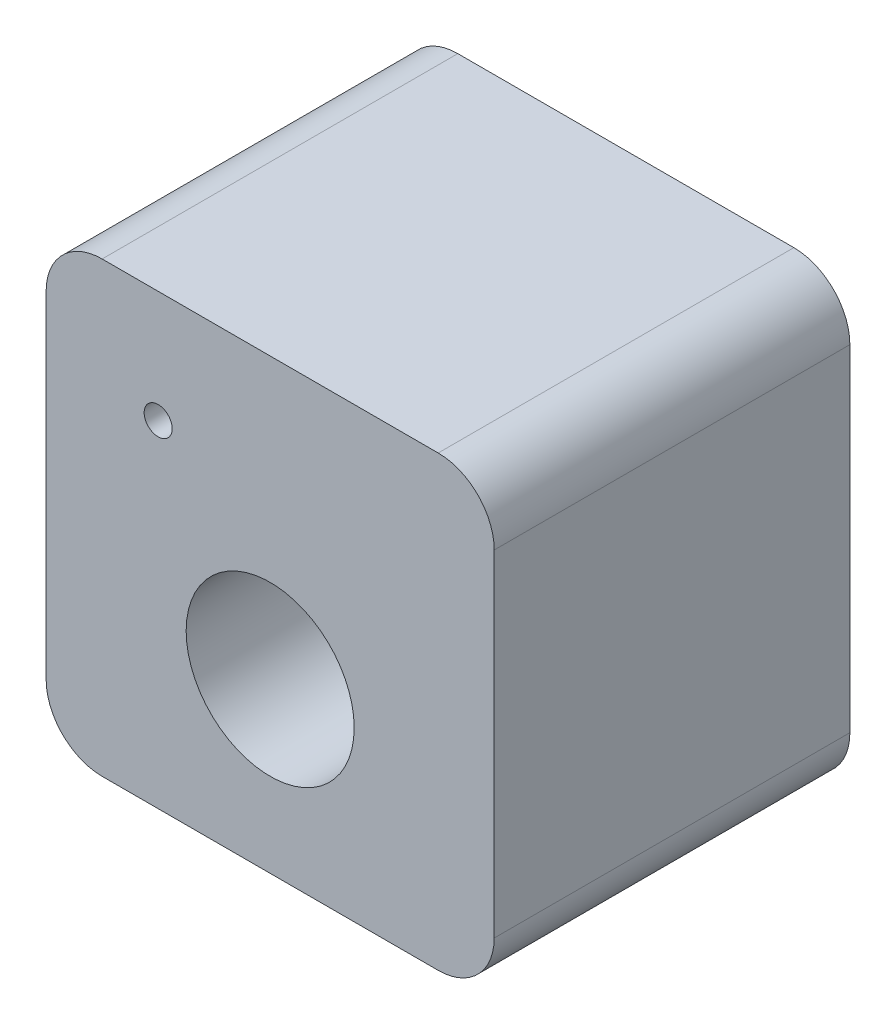
from build123d import *

# Parameters (mm, degrees)
SKETCH1_W           = 8
SKETCH1_H           = 8
SKETCH1_R           = 1.5
SKETCH1_R_2         = 0.25
BOSS_EXTRUDE1_DEPTH = 6.35
FILLET1_R           = 1


with BuildPart() as part:
    # Sketch1 → Boss-Extrude1 (new body)
    with BuildSketch(Plane.XY):
        with Locations((4, 4)):
            Rectangle(SKETCH1_W, SKETCH1_H)
        with Locations((4, 3)):
            Circle(SKETCH1_R, mode=Mode.SUBTRACT)
        with Locations((2, 6)):
            Circle(SKETCH1_R_2, mode=Mode.SUBTRACT)
    extrude(amount=BOSS_EXTRUDE1_DEPTH)

    # Fillet1
    fillet1_edges = [part.edges().sort_by_distance(p)[0] for p in [
        (0, 8, 3.175),
        (8, 8, 3.175),
        (8, 0, 3.175),
        (0, 0, 3.175),
    ]]
    fillet(fillet1_edges, radius=FILLET1_R)


solid = part.part
